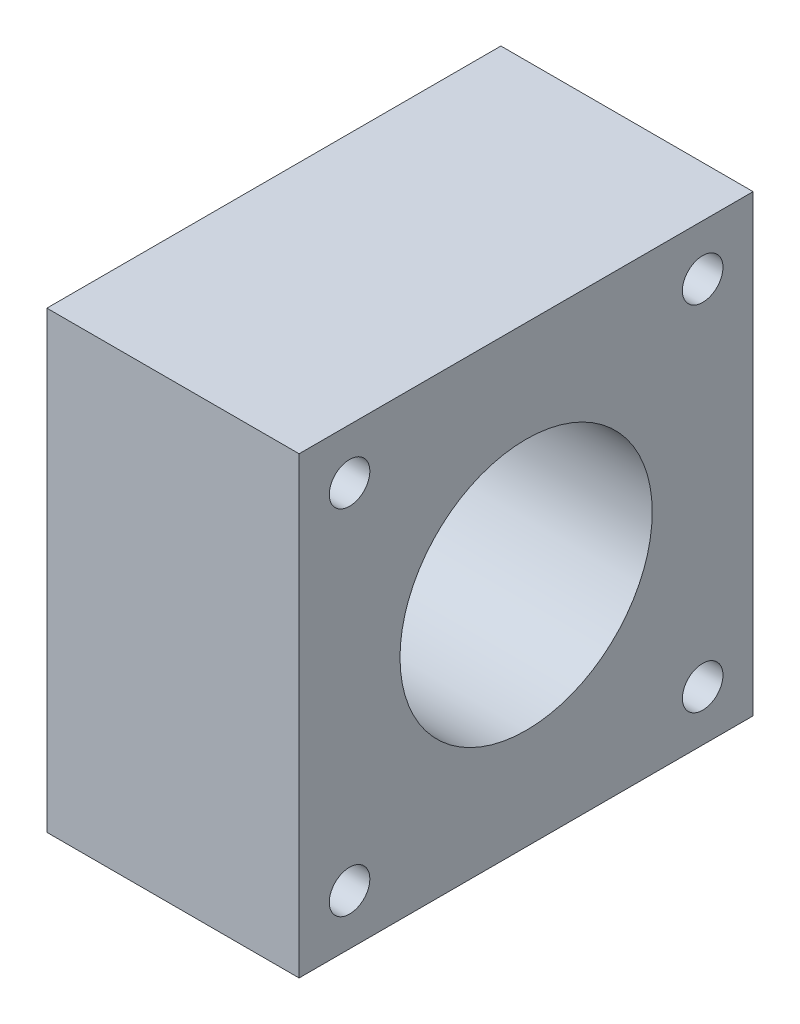
from build123d import *

# Parameters (mm, degrees)
SKETCH2_W               = 57.15
SKETCH2_H               = 57.15
BOSS_EXTRUDE2_DEPTH     = 31.75
SKETCH3_R               = 15.875
CUT_EXTRUDE1_DEPTH      = 87.834944003
CUT_EXTRUDE2_DEPTH      = 2.54
FILLET1_R               = 3.175
F_1_4_20_TAPPED_HOLE1_D = 5.1054


with BuildPart() as part:
    # Sketch2 → Boss-Extrude2 (new body)
    with BuildSketch(Plane(origin=(0, 0, 0), x_dir=(0, 0, -1), z_dir=(1, 0, 0))):
        with Locations((28.575, 28.575)):
            Rectangle(SKETCH2_W, SKETCH2_H)
    extrude(amount=BOSS_EXTRUDE2_DEPTH)

    # Sketch3 → Cut-Extrude1 (cut, through all)
    with BuildSketch(Plane(origin=(31.75, 0, 0), x_dir=(0, 0, -1), z_dir=(1, 0, 0))):
        with Locations((28.575, 28.575)):
            Circle(SKETCH3_R)
    extrude(amount=-CUT_EXTRUDE1_DEPTH, mode=Mode.SUBTRACT)

    # Sketch4 → Cut-Extrude2 (cut)
    with BuildSketch(Plane.ZY):
        with BuildLine():
            Line((-36.188382543, 46.0375), (-20.961617457, 46.0375))
            ThreePointArc((-20.961617457, 46.0375), (-9.525, 28.575), (-20.961617457, 11.1125))
            Line((-20.961617457, 11.1125), (-36.188382543, 11.1125))
            ThreePointArc((-36.188382543, 11.1125), (-47.625, 28.575), (-36.188382543, 46.0375))
        make_face()
    extrude(amount=-CUT_EXTRUDE2_DEPTH, mode=Mode.SUBTRACT)

    # Fillet1
    fillet1_edges = [part.edges().sort_by_distance(p)[0] for p in [
        (1.27, 11.1125, -36.188382543),
        (1.27, 46.0375, -36.188382543),
        (1.27, 46.0375, -20.961617457),
        (1.27, 11.1125, -20.961617457),
    ]]
    fillet(fillet1_edges, radius=FILLET1_R)

    # 1/4-20 Tapped Hole1 (through all)
    with Locations(Plane(origin=(31.75, 0, 0), x_dir=(0, 0, -1), z_dir=(1, 0, 0))):
        with Locations((6.35, 50.8), (50.8, 50.8), (50.8, 6.35), (6.35, 6.35), (28.575, 28.575)):
            Hole(F_1_4_20_TAPPED_HOLE1_D / 2)


solid = part.part
